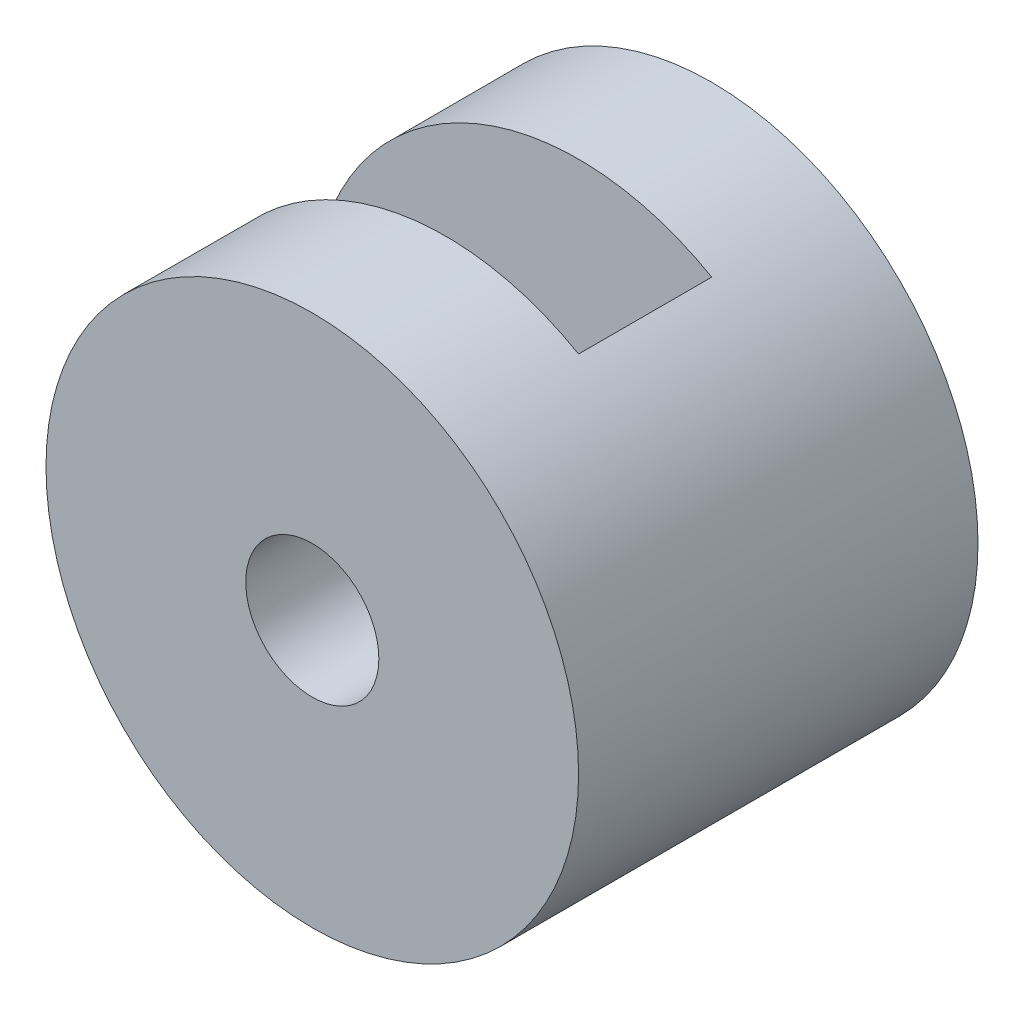
from build123d import *

# Parameters (mm, degrees)
CROQUIS1_R              = 20
CROQUIS1_R_2            = 5
SALIENTE_EXTRUIR1_DEPTH = 15
CROQUIS6_R              = 10
CORTAR_EXTRUIR6_DEPTH   = 5
CROQUIS7_W              = 10
CROQUIS7_H              = 30
CORTAR_EXTRUIR7_DEPTH   = 36
CROQUIS8_W              = 10
CROQUIS8_H              = 20
CORTAR_EXTRUIR9_DEPTH   = 10


with BuildPart() as part:
    # Croquis1 → Saliente-Extruir1 (new, symmetric)
    with BuildSketch(Plane.XY):
        Circle(CROQUIS1_R)
        Circle(CROQUIS1_R_2, mode=Mode.SUBTRACT)
    extrude(amount=SALIENTE_EXTRUIR1_DEPTH, both=True)

    # Croquis6 → Cortar-Extruir6 (cut, symmetric)
    with BuildSketch(Plane.XY):
        Circle(CROQUIS6_R)
    extrude(amount=CORTAR_EXTRUIR6_DEPTH, both=True, mode=Mode.SUBTRACT)

    # Croquis7 → Cortar-Extruir7 (cut)
    with BuildSketch(Plane(origin=(0, 0, 0), x_dir=(0, 0, -1), z_dir=(1, 0, 0))):
        with Locations((0, 5)):
            Rectangle(CROQUIS7_W, CROQUIS7_H)
    extrude(amount=-CORTAR_EXTRUIR7_DEPTH, mode=Mode.SUBTRACT)

    # Croquis8 → Cortar-Extruir9 (cut)
    with BuildSketch(Plane.ZY):
        with Locations((0, 10)):
            Rectangle(CROQUIS8_W, CROQUIS8_H)
    extrude(amount=-CORTAR_EXTRUIR9_DEPTH, mode=Mode.SUBTRACT)


solid = part.part
